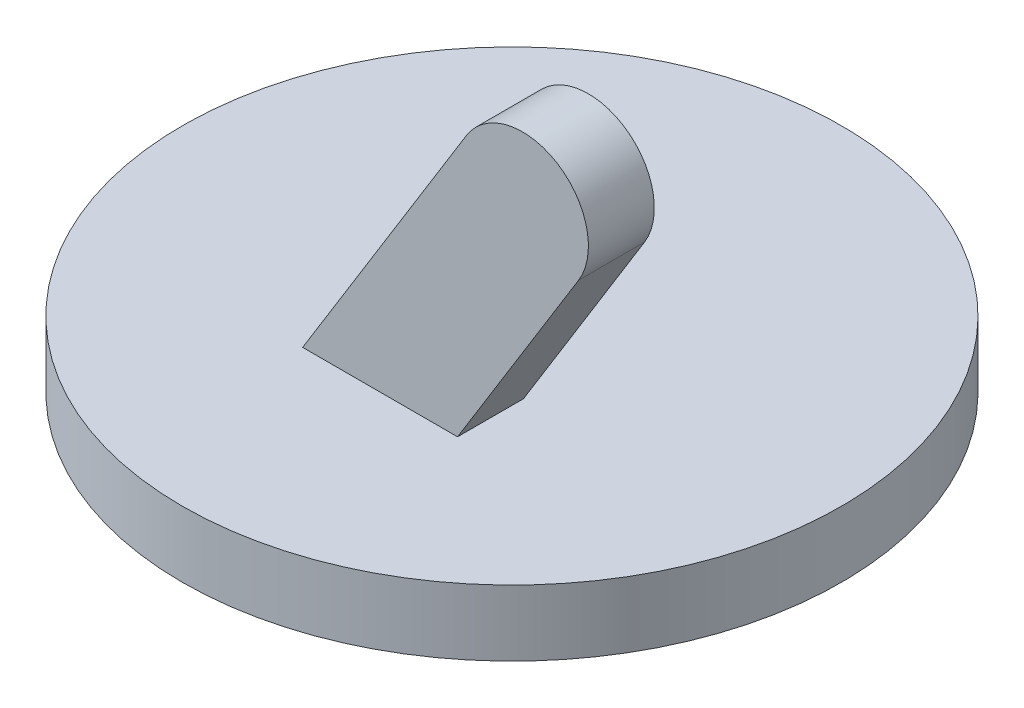
from build123d import *

# Parameters (mm, degrees)
SKETCH_1_R      = 25
EXTRUDE_1_DEPTH = 5
EXTRUDE_2_DEPTH = 5


with BuildPart() as part:
    # 草图1 → 凸台-拉伸1 (new body)
    with BuildSketch(Plane(origin=(0, 0, 0), x_dir=(1, 0, 0), z_dir=(0, 1, 0))):
        with Locations(Location((0, 0, 0), (0, 0, 270))):
            Circle(SKETCH_1_R)
    extrude(amount=EXTRUDE_1_DEPTH)

    # 草图2 → 凸台-拉伸2 (add)
    with BuildSketch(Plane.XY.offset(5)):
        with BuildLine():
            Line((5.875511267, 5), (15.054948865, 19.8740887))
            ThreePointArc((15.054948865, 19.8740887), (13.4259113, 26.754948865), (6.545051135, 25.1259113))
            Line((6.545051135, 25.1259113), (-5.875511267, 5))
            Line((-5.875511267, 5), (5.875511267, 5))
        make_face()
    extrude(amount=EXTRUDE_2_DEPTH)


solid = part.part
